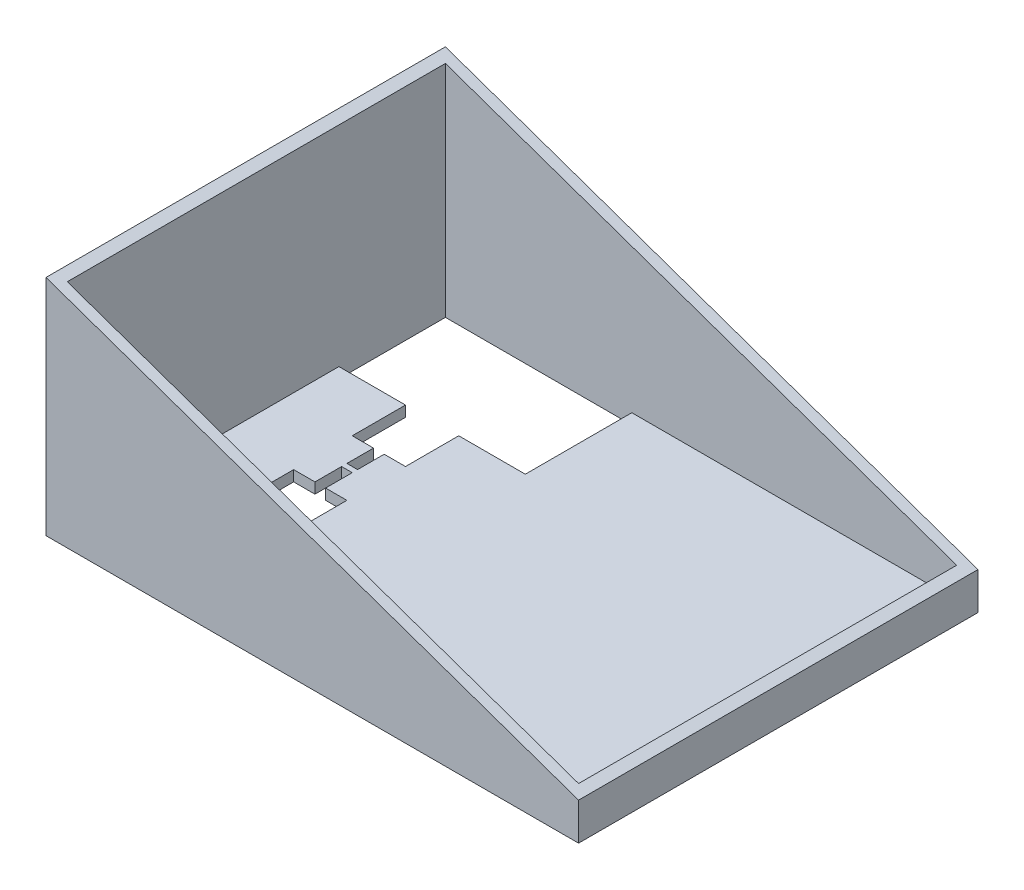
from build123d import *

# Parameters (mm, degrees)
SKETCH1_W           = 200
SKETCH1_H           = 150
SKETCH1_W_2         = 192
SKETCH1_H_2         = 142
BOSS_EXTRUDE2_DEPTH = 4
SKETCH2_W           = 200
SKETCH2_H           = 150
SKETCH2_W_2         = 192
SKETCH2_H_2         = 142
BOSS_EXTRUDE3_DEPTH = 80
CUT_EXTRUDE1_DEPTH  = 150


with BuildPart() as part:
    # Sketch1 → Boss-Extrude2 (new body)
    # profile 1 of 3: a face of its own
    with BuildSketch(Plane(origin=(0, 0, 0), x_dir=(1, 0, 0), z_dir=(0, 1, 0))):
        with Locations((-100, 75)):
            Rectangle(SKETCH1_W, SKETCH1_H)
        with Locations((-100, 75)):
            Rectangle(SKETCH1_W_2, SKETCH1_H_2, mode=Mode.SUBTRACT)
    # profile 2 of 3: a face of its own
    with BuildSketch(Plane(origin=(0, 0, 0), x_dir=(1, 0, 0), z_dir=(0, 1, 0))):
        Polygon((-4, 75), (-196, 75), (-196, 44), (-171, 44), (-171, 64), (-163, 64), (-163, 74), (-159, 74), (-159, 64), (-151, 64), (-151, 44), (-126, 44), (-126, 4), (-4, 4), align=None)
    # profile 3 of 3: a face of its own
    with BuildSketch(Plane(origin=(0, 0, 0), x_dir=(1, 0, 0), z_dir=(0, 1, 0))):
        Polygon((-196, 106), (-196, 75), (-4, 75), (-4, 146), (-126, 146), (-126, 106), (-151, 106), (-151, 86), (-159, 86), (-159, 76), (-163, 76), (-163, 86), (-171, 86), (-171, 106), align=None)
    extrude(amount=BOSS_EXTRUDE2_DEPTH)

    # Sketch2 → Boss-Extrude3 (add)
    with BuildSketch(Plane(origin=(0, 4, 0), x_dir=(1, 0, 0), z_dir=(0, 1, 0))):
        with Locations((-100, 75)):
            Rectangle(SKETCH2_W, SKETCH2_H)
        with Locations((-100, 75)):
            Rectangle(SKETCH2_W_2, SKETCH2_H_2, mode=Mode.SUBTRACT)
    extrude(amount=BOSS_EXTRUDE3_DEPTH)

    # Sketch3 → Cut-Extrude1 (cut)
    with BuildSketch(Plane.XY):
        Polygon((-200, 84), (0, 14), (0, 84), align=None)
    extrude(amount=-CUT_EXTRUDE1_DEPTH, mode=Mode.SUBTRACT)


solid = part.part
